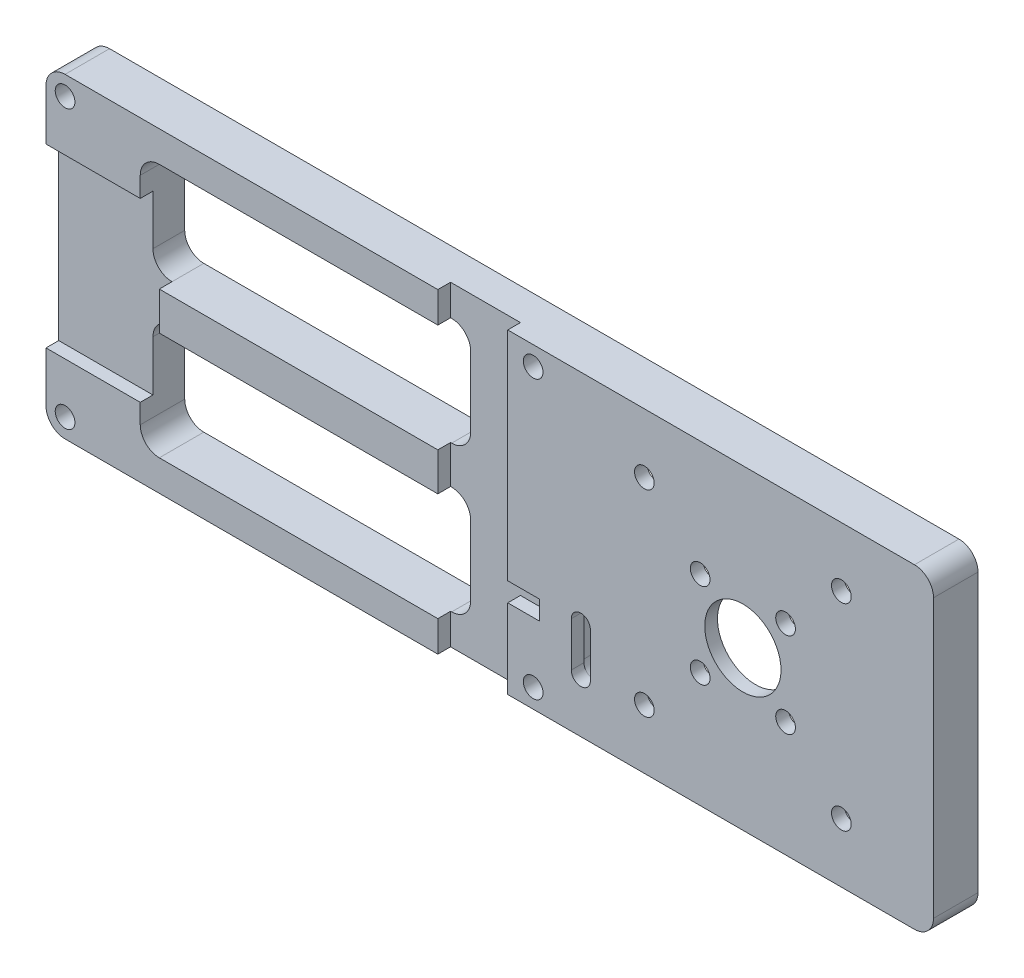
from build123d import *

# Parameters (mm, degrees)
SKETCH_1_R          = 1.55
SKETCH_1_R_2        = 6
EXTRUDE_1_DEPTH     = 7
CUT_EXTRUDE_START   = -2
CUT_EXTRUDE_3_DEPTH = 2
SKETCH_4_R          = 2.5
CUT_EXTRUDE_4_DEPTH = 3
CUT_EXTRUDE_5_DEPTH = 5
CUT_EXTRUDE_6_DEPTH = 2
SKETCH_7_W          = 5
SKETCH_7_H          = 3
CUT_EXTRUDE_7_DEPTH = 2


with BuildPart() as part:
    # 草图1 → 凸台-拉伸1 (new body)
    with BuildSketch(Plane.XY):
        with BuildLine():
            Line((0, 3), (73.66, 3))
            Line((73.66, 3), (133.66, 3))
            ThreePointArc((133.66, 3), (135.781320344, 2.121320344), (136.66, 0))
            Line((136.66, 0), (136.66, -21.844))
            Line((136.66, -21.844), (136.66, -43.688))
            ThreePointArc((136.66, -43.688), (135.781320344, -45.809320344), (133.66, -46.688))
            Line((133.66, -46.688), (73.66, -46.688))
            Line((73.66, -46.688), (0, -46.688))
            ThreePointArc((0, -46.688), (-2.121320344, -45.809320344), (-3, -43.688))
            Line((-3, -43.688), (-3, 0))
            ThreePointArc((-3, 0), (-2.121320344, 2.121320344), (0, 3))
        make_face()
        Circle(SKETCH_1_R, mode=Mode.SUBTRACT)
        with Locations((73.66, 0)):
            Circle(SKETCH_1_R, mode=Mode.SUBTRACT)
        with Locations((0, -43.688)):
            Circle(SKETCH_1_R, mode=Mode.SUBTRACT)
        with Locations((73.66, -43.688)):
            Circle(SKETCH_1_R, mode=Mode.SUBTRACT)
        with Locations((106.66, -21.844)):
            Circle(SKETCH_1_R_2, mode=Mode.SUBTRACT)
        with Locations((91.16, -6.344)):
            Circle(SKETCH_1_R, mode=Mode.SUBTRACT)
        with Locations(Location((91.16, -37.344, 0), (0, 0, 180))):
            Circle(SKETCH_1_R, mode=Mode.SUBTRACT)
        with Locations((122.16, -37.344)):
            Circle(SKETCH_1_R, mode=Mode.SUBTRACT)
        with Locations(Location((122.16, -6.344, 0), (0, 0, 180))):
            Circle(SKETCH_1_R, mode=Mode.SUBTRACT)
        with Locations((99.942485579, -15.126485579)):
            Circle(SKETCH_1_R, mode=Mode.SUBTRACT)
        with Locations((113.377514421, -15.126485579)):
            Circle(SKETCH_1_R, mode=Mode.SUBTRACT)
        with Locations((113.377514421, -28.561514421)):
            Circle(SKETCH_1_R, mode=Mode.SUBTRACT)
        with Locations((99.942485579, -28.561514421)):
            Circle(SKETCH_1_R, mode=Mode.SUBTRACT)
        with BuildLine():
            Line((11.83, -15.844), (11.83, -4.844))
            ThreePointArc((11.83, -4.844), (12.708679656, -2.722679656), (14.83, -1.844))
            Line((14.83, -1.844), (36.83, -1.844))
            Line((36.83, -1.844), (58.83, -1.844))
            ThreePointArc((58.83, -1.844), (60.951320344, -2.722679656), (61.83, -4.844))
            Line((61.83, -4.844), (61.83, -15.844))
            ThreePointArc((61.83, -15.844), (60.951320344, -17.965320344), (58.83, -18.844))
            Line((58.83, -18.844), (36.83, -18.844))
            Line((36.83, -18.844), (14.83, -18.844))
            ThreePointArc((14.83, -18.844), (12.708679656, -17.965320344), (11.83, -15.844))
        make_face(mode=Mode.SUBTRACT)
        with BuildLine():
            Line((36.83, -41.844), (58.83, -41.844))
            ThreePointArc((58.83, -41.844), (60.951320344, -40.965320344), (61.83, -38.844))
            Line((61.83, -38.844), (61.83, -27.844))
            ThreePointArc((61.83, -27.844), (60.951320344, -25.722679656), (58.83, -24.844))
            Line((58.83, -24.844), (36.83, -24.844))
            Line((36.83, -24.844), (14.83, -24.844))
            ThreePointArc((14.83, -24.844), (12.708679656, -25.722679656), (11.83, -27.844))
            Line((11.83, -27.844), (11.83, -38.844))
            ThreePointArc((11.83, -38.844), (12.708679656, -40.965320344), (14.83, -41.844))
            Line((14.83, -41.844), (36.83, -41.844))
        make_face(mode=Mode.SUBTRACT)
    extrude(amount=EXTRUDE_1_DEPTH)

    # 草图2 → 切除-拉伸3 (cut)
    with BuildSketch(Plane.XY.offset(7).offset(CUT_EXTRUDE_START)):
        with BuildLine():
            Line((1.933137513, -8), (11.83, -8))
            Line((11.83, -8), (11.83, -15.844))
            ThreePointArc((11.83, -15.844), (12.708679656, -17.965320344), (14.83, -18.844))
            Line((14.83, -18.844), (14.83, -23))
            Line((14.83, -23), (14.83, -24.844))
            ThreePointArc((14.83, -24.844), (12.708679656, -25.722679656), (11.83, -27.844))
            Line((11.83, -27.844), (11.83, -35.779934467))
            Line((11.83, -35.779934467), (1.933137513, -35.779934467))
            Line((1.933137513, -35.779934467), (-3, -35.779934467))
            Line((-3, -35.779934467), (-3, -23))
            Line((-3, -23), (-3, -8))
            Line((-3, -8), (1.933137513, -8))
        make_face()
        Polygon((69.66, -21.844), (69.66, 3), (67.66, 3), (58.66, 3), (58.66, -21.889967233), (58.66, -46.688), (67.66, -46.688), (69.66, -46.688), align=None)
    extrude(amount=CUT_EXTRUDE_3_DEPTH, mode=Mode.SUBTRACT)

    # 草图4 → 切除-拉伸4 (cut)
    with BuildSketch(Plane(origin=(0, 0, 0), x_dir=(-1, 0, 0), z_dir=(0, 0, -1))):
        with Locations((-73.66, 0)):
            Circle(SKETCH_4_R)
        with Locations((-73.66, -43.688)):
            Circle(SKETCH_4_R)
        Circle(SKETCH_4_R)
        with Locations((0, -43.688)):
            Circle(SKETCH_4_R)
    extrude(amount=-CUT_EXTRUDE_4_DEPTH, mode=Mode.SUBTRACT)

    # 草图5 → 切除-拉伸5 (cut)
    with BuildSketch(Plane(origin=(0, 0, 0), x_dir=(-1, 0, 0), z_dir=(0, 0, -1))):
        with BuildLine():
            Line((-85.41, -3.594), (-81.41, -3.594))
            ThreePointArc((-81.41, -3.594), (-79.995786438, -4.179786438), (-79.41, -5.594))
            Line((-79.41, -5.594), (-79.41, -37.094))
            Line((-79.41, -37.094), (-79.41, -38.094))
            ThreePointArc((-79.41, -38.094), (-79.995786438, -39.508213562), (-81.41, -40.094))
            Line((-81.41, -40.094), (-85.41, -40.094))
            ThreePointArc((-85.41, -40.094), (-86.288679656, -42.215320344), (-88.41, -43.094))
            Line((-88.41, -43.094), (-124.91, -43.094))
            ThreePointArc((-124.91, -43.094), (-127.031320344, -42.215320344), (-127.91, -40.094))
            Line((-127.91, -40.094), (-127.91, -3.594))
            ThreePointArc((-127.91, -3.594), (-127.031320344, -1.472679656), (-124.91, -0.594))
            Line((-124.91, -0.594), (-88.41, -0.594))
            ThreePointArc((-88.41, -0.594), (-86.288679656, -1.472679656), (-85.41, -3.594))
        make_face()
    extrude(amount=-CUT_EXTRUDE_5_DEPTH, mode=Mode.SUBTRACT)

    # 草图6 → 切除-拉伸6 (cut)
    with BuildSketch(Plane(origin=(0, 0, 5), x_dir=(-1, 0, 0), z_dir=(0, 0, -1))):
        with BuildLine():
            Line((-82.66, -31.344), (-82.66, -38.344))
            ThreePointArc((-82.66, -38.344), (-81.16, -39.844), (-79.66, -38.344))
            Line((-79.66, -38.344), (-79.66, -31.344))
            ThreePointArc((-79.66, -31.344), (-81.16, -29.844), (-82.66, -31.344))
        make_face()
    extrude(amount=-CUT_EXTRUDE_6_DEPTH, mode=Mode.SUBTRACT)

    # 草图7 → 切除-拉伸7 (cut)
    with BuildSketch(Plane.XY.offset(7)):
        with Locations((72.16, -32.688)):
            Rectangle(SKETCH_7_W, SKETCH_7_H)
    extrude(amount=-CUT_EXTRUDE_7_DEPTH, mode=Mode.SUBTRACT)


solid = part.part
